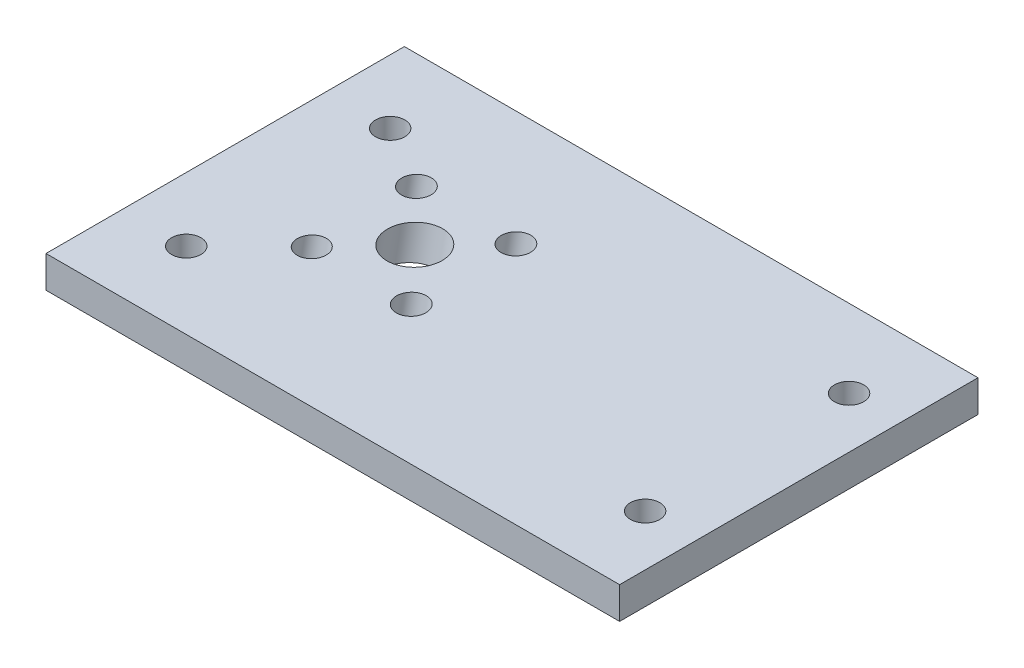
from build123d import *

# Parameters (mm, degrees)
SKETCH1_W           = 90
SKETCH1_H           = 56.23
BOSS_EXTRUDE1_DEPTH = 5
SKETCH2_R           = 2.3
CUT_EXTRUDE1_DEPTH  = 15
SKETCH7_R           = 2.3
CUT_EXTRUDE3_DEPTH  = 45
SKETCH12_R          = 2.257742522
SKETCH12_R_2        = 2.3
SKETCH12_R_3        = 4.287283452
CUT_EXTRUDE5_DEPTH  = 20


with BuildPart() as part:
    # Sketch1 → Boss-Extrude1 (new body)
    with BuildSketch(Plane(origin=(0, 0, 0), x_dir=(1, 0, 0), z_dir=(0, 1, 0))):
        with Locations((45, 28.115)):
            Rectangle(SKETCH1_W, SKETCH1_H)
    extrude(amount=BOSS_EXTRUDE1_DEPTH)

    # Sketch2 → Cut-Extrude1 (cut)
    with BuildSketch(Plane(origin=(0, 5, 0), x_dir=(1, 0, 0), z_dir=(0, 1, 0))):
        with Locations(Location((82, 12, 0), (0, 0, 270))):
            Circle(SKETCH2_R)
        with Locations(Location((10, 12, 0), (0, 0, 270))):
            Circle(SKETCH2_R)
    extrude(amount=-CUT_EXTRUDE1_DEPTH, mode=Mode.SUBTRACT)

    # Sketch7 → Cut-Extrude3 (cut)
    with BuildSketch(Plane(origin=(0, 5, 0), x_dir=(1, 0, 0), z_dir=(0, 1, 0))):
        with Locations(Location((82, 44, 0), (0, 0, 270))):
            Circle(SKETCH7_R)
        with Locations(Location((10, 44, 0), (0, 0, 270))):
            Circle(SKETCH7_R)
    extrude(amount=-CUT_EXTRUDE3_DEPTH, mode=Mode.SUBTRACT)

    # Sketch12 → Cut-Extrude5 (cut)
    with BuildSketch(Plane(origin=(0, 15.35002401, -2.983742412), x_dir=(-1, 0, 0), z_dir=(0, 0.9816271834476639, -0.19080899537654525))):
        with Locations(Location((-19.945482257, -20.397734662, 0), (0, 0, 270))):
            Circle(SKETCH12_R)
        with Locations(Location((-35.559756703, -20.397734662, 0), (0, 0, 270))):
            Circle(SKETCH12_R_2)
        with Locations(Location((-35.559756703, -36.512466621, 0), (0, 0, 270))):
            Circle(SKETCH12_R_2)
        with Locations(Location((-19.945482257, -36.512466621, 0), (0, 0, 270))):
            Circle(SKETCH12_R_2)
        with Locations(Location((-27.75261948, -28.605237896, 0), (0, 0, 270))):
            Circle(SKETCH12_R_3)
    extrude(amount=-CUT_EXTRUDE5_DEPTH, mode=Mode.SUBTRACT)


solid = part.part
